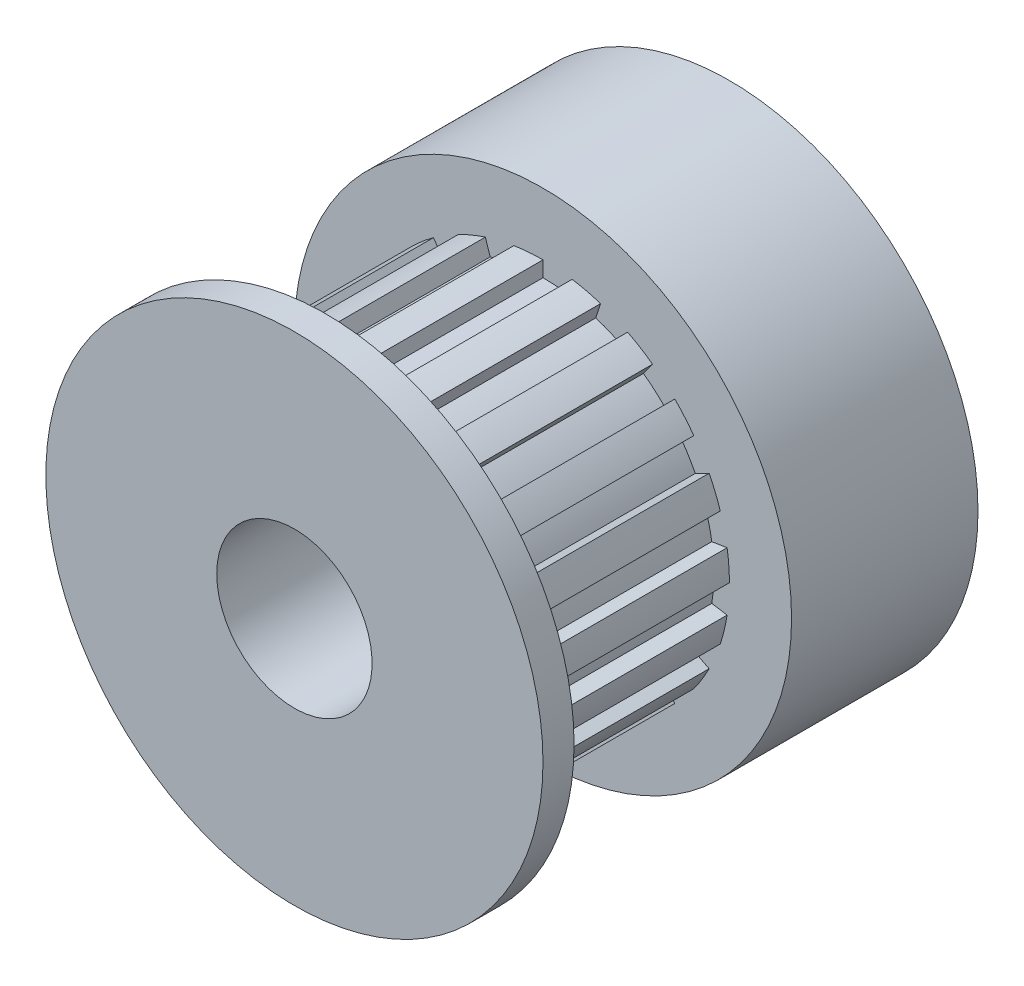
from build123d import *

# Parameters (mm, degrees)
SKETCH1_R           = 8
BOSS_EXTRUDE1_DEPTH = 6
BOSS_EXTRUDE2_DEPTH = 7
SKETCH3_R           = 8
BOSS_EXTRUDE3_DEPTH = 1
SKETCH4_R           = 2.5
CUT_EXTRUDE1_DEPTH  = 19
SKETCH5_R           = 1.7
CUT_EXTRUDE2_DEPTH  = 19


with BuildPart() as part:
    # Sketch1 → Boss-Extrude1 (new body)
    with BuildSketch(Plane.XY):
        Circle(SKETCH1_R)
    extrude(amount=BOSS_EXTRUDE1_DEPTH)

    # Sketch2 → Boss-Extrude2 (add)
    with BuildSketch(Plane.XY.offset(6)):
        with BuildLine():
            Line((0, 5.5), (0, 6))
            ThreePointArc((0, 6), (-0.470754574, 5.981504002), (-0.93860679, 5.926130044))
            Line((-0.93860679, 5.926130044), (-0.860389558, 5.432285873))
            ThreePointArc((-0.860389558, 5.432285873), (-1.283949501, 5.348034562), (-1.699593469, 5.23081084))
            Line((-1.699593469, 5.23081084), (-1.854101966, 5.706339098))
            ThreePointArc((-1.854101966, 5.706339098), (-2.296100594, 5.543277195), (-2.723942998, 5.346039145))
            Line((-2.723942998, 5.346039145), (-2.496947749, 4.900535883))
            ThreePointArc((-2.496947749, 4.900535883), (-2.873742106, 4.689520904), (-3.232818888, 4.449593469))
            Line((-3.232818888, 4.449593469), (-3.526711514, 4.854101966))
            ThreePointArc((-3.526711514, 4.854101966), (-3.89668829, 4.562435794), (-4.242640687, 4.242640687))
            Line((-4.242640687, 4.242640687), (-3.889087297, 3.889087297))
            ThreePointArc((-3.889087297, 3.889087297), (-4.182232811, 3.571964266), (-4.449593469, 3.232818888))
            Line((-4.449593469, 3.232818888), (-4.854101966, 3.526711514))
            ThreePointArc((-4.854101966, 3.526711514), (-5.115840986, 3.134991388), (-5.346039145, 2.723942998))
            Line((-5.346039145, 2.723942998), (-4.900535883, 2.496947749))
            ThreePointArc((-4.900535883, 2.496947749), (-5.081337429, 2.104758878), (-5.23081084, 1.699593469))
            Line((-5.23081084, 1.699593469), (-5.706339098, 1.854101966))
            ThreePointArc((-5.706339098, 1.854101966), (-5.834219522, 1.400672183), (-5.926130044, 0.93860679))
            Line((-5.926130044, 0.93860679), (-5.432285873, 0.860389558))
            ThreePointArc((-5.432285873, 0.860389558), (-5.483045336, 0.431525027), (-5.5, 0))
            Line((-5.5, 0), (-6, 0))
            ThreePointArc((-6, 0), (-5.981504002, -0.470754574), (-5.926130044, -0.93860679))
            Line((-5.926130044, -0.93860679), (-5.432285873, -0.860389558))
            ThreePointArc((-5.432285873, -0.860389558), (-5.348034562, -1.283949501), (-5.23081084, -1.699593469))
            Line((-5.23081084, -1.699593469), (-5.706339098, -1.854101966))
            ThreePointArc((-5.706339098, -1.854101966), (-5.543277195, -2.296100594), (-5.346039145, -2.723942998))
            Line((-5.346039145, -2.723942998), (-4.900535883, -2.496947749))
            ThreePointArc((-4.900535883, -2.496947749), (-4.689520904, -2.873742106), (-4.449593469, -3.232818888))
            Line((-4.449593469, -3.232818888), (-4.854101966, -3.526711514))
            ThreePointArc((-4.854101966, -3.526711514), (-4.562435794, -3.89668829), (-4.242640687, -4.242640687))
            Line((-4.242640687, -4.242640687), (-3.889087297, -3.889087297))
            ThreePointArc((-3.889087297, -3.889087297), (-3.571964266, -4.182232811), (-3.232818888, -4.449593469))
            Line((-3.232818888, -4.449593469), (-3.526711514, -4.854101966))
            ThreePointArc((-3.526711514, -4.854101966), (-3.134991388, -5.115840986), (-2.723942998, -5.346039145))
            Line((-2.723942998, -5.346039145), (-2.496947749, -4.900535883))
            ThreePointArc((-2.496947749, -4.900535883), (-2.104758878, -5.081337429), (-1.699593469, -5.23081084))
            Line((-1.699593469, -5.23081084), (-1.854101966, -5.706339098))
            ThreePointArc((-1.854101966, -5.706339098), (-1.400672183, -5.834219522), (-0.93860679, -5.926130044))
            Line((-0.93860679, -5.926130044), (-0.860389558, -5.432285873))
            ThreePointArc((-0.860389558, -5.432285873), (-0.431525027, -5.483045336), (0, -5.5))
            Line((0, -5.5), (0, -6))
            ThreePointArc((0, -6), (0.470754574, -5.981504002), (0.93860679, -5.926130044))
            Line((0.93860679, -5.926130044), (0.860389558, -5.432285873))
            ThreePointArc((0.860389558, -5.432285873), (1.283949501, -5.348034562), (1.699593469, -5.23081084))
            Line((1.699593469, -5.23081084), (1.854101966, -5.706339098))
            ThreePointArc((1.854101966, -5.706339098), (2.296100594, -5.543277195), (2.723942998, -5.346039145))
            Line((2.723942998, -5.346039145), (2.496947749, -4.900535883))
            ThreePointArc((2.496947749, -4.900535883), (2.873742106, -4.689520904), (3.232818888, -4.449593469))
            Line((3.232818888, -4.449593469), (3.526711514, -4.854101966))
            ThreePointArc((3.526711514, -4.854101966), (3.89668829, -4.562435794), (4.242640687, -4.242640687))
            Line((4.242640687, -4.242640687), (3.889087297, -3.889087297))
            ThreePointArc((3.889087297, -3.889087297), (4.182232811, -3.571964266), (4.449593469, -3.232818888))
            Line((4.449593469, -3.232818888), (4.854101966, -3.526711514))
            ThreePointArc((4.854101966, -3.526711514), (5.115840986, -3.134991388), (5.346039145, -2.723942998))
            Line((5.346039145, -2.723942998), (4.900535883, -2.496947749))
            ThreePointArc((4.900535883, -2.496947749), (5.081337429, -2.104758878), (5.23081084, -1.699593469))
            Line((5.23081084, -1.699593469), (5.706339098, -1.854101966))
            ThreePointArc((5.706339098, -1.854101966), (5.834219522, -1.400672183), (5.926130044, -0.93860679))
            Line((5.926130044, -0.93860679), (5.432285873, -0.860389558))
            ThreePointArc((5.432285873, -0.860389558), (5.483045336, -0.431525027), (5.5, 0))
            Line((5.5, 0), (6, 0))
            ThreePointArc((6, 0), (5.981504002, 0.470754574), (5.926130044, 0.93860679))
            Line((5.926130044, 0.93860679), (5.432285873, 0.860389558))
            ThreePointArc((5.432285873, 0.860389558), (5.348034562, 1.283949501), (5.23081084, 1.699593469))
            Line((5.23081084, 1.699593469), (5.706339098, 1.854101966))
            ThreePointArc((5.706339098, 1.854101966), (5.543277195, 2.296100594), (5.346039145, 2.723942998))
            Line((5.346039145, 2.723942998), (4.900535883, 2.496947749))
            ThreePointArc((4.900535883, 2.496947749), (4.689520904, 2.873742106), (4.449593469, 3.232818888))
            Line((4.449593469, 3.232818888), (4.854101966, 3.526711514))
            ThreePointArc((4.854101966, 3.526711514), (4.562435794, 3.89668829), (4.242640687, 4.242640687))
            Line((4.242640687, 4.242640687), (3.889087297, 3.889087297))
            ThreePointArc((3.889087297, 3.889087297), (3.571964266, 4.182232811), (3.232818888, 4.449593469))
            Line((3.232818888, 4.449593469), (3.526711514, 4.854101966))
            ThreePointArc((3.526711514, 4.854101966), (3.134991388, 5.115840986), (2.723942998, 5.346039145))
            Line((2.723942998, 5.346039145), (2.496947749, 4.900535883))
            ThreePointArc((2.496947749, 4.900535883), (2.104758878, 5.081337429), (1.699593469, 5.23081084))
            Line((1.699593469, 5.23081084), (1.854101966, 5.706339098))
            ThreePointArc((1.854101966, 5.706339098), (1.400672183, 5.834219522), (0.93860679, 5.926130044))
            Line((0.93860679, 5.926130044), (0.860389558, 5.432285873))
            ThreePointArc((0.860389558, 5.432285873), (0.431525027, 5.483045336), (0, 5.5))
        make_face()
    extrude(amount=BOSS_EXTRUDE2_DEPTH)

    # Sketch3 → Boss-Extrude3 (add)
    with BuildSketch(Plane.XY.offset(13)):
        Circle(SKETCH3_R)
    extrude(amount=BOSS_EXTRUDE3_DEPTH)

    # Sketch4 → Cut-Extrude1 (cut, through all)
    with BuildSketch(Plane(origin=(0, 0, 0), x_dir=(-1, 0, 0), z_dir=(0, 0, -1))):
        Circle(SKETCH4_R)
    extrude(amount=-CUT_EXTRUDE1_DEPTH, mode=Mode.SUBTRACT)

    # Sketch5 → Cut-Extrude2 (cut, through all)
    with BuildSketch(Plane(origin=(0, 0, 0), x_dir=(1, 0, 0), z_dir=(0, 1, 0))):
        with Locations(Location((0, -3, 0), (0, 0, 270))):
            Circle(SKETCH5_R)
    extrude(amount=-CUT_EXTRUDE2_DEPTH, mode=Mode.SUBTRACT)


solid = part.part
